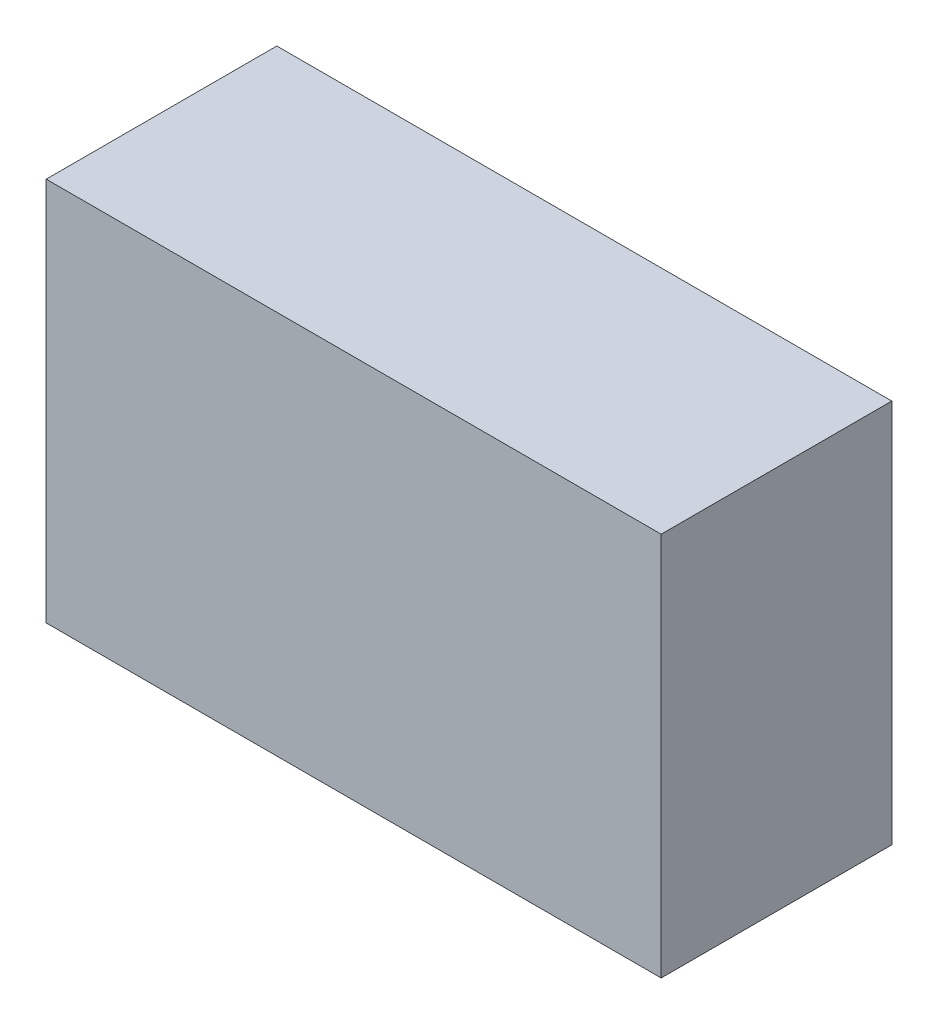
from build123d import *

# Parameters (mm, degrees)
SKETCH_1_W          = 16
SKETCH_1_H          = 10
EXTRUDE_1_DEPTH     = 3
SKETCH_2_R          = 2
CUT_EXTRUDE_1_DEPTH = 5


with BuildPart() as part:
    # 스케치1 → 보스-돌출1 (new, symmetric)
    with BuildSketch(Plane.XY):
        Rectangle(SKETCH_1_W, SKETCH_1_H)
    extrude(amount=EXTRUDE_1_DEPTH, both=True)

    # 스케치2 → 컷-돌출1 (cut)
    with BuildSketch(Plane.XZ.offset(5)):
        with Locations(Location((0, 0, 0), (0, 0, 270))):
            Circle(SKETCH_2_R)
    extrude(amount=-CUT_EXTRUDE_1_DEPTH, mode=Mode.SUBTRACT)


solid = part.part
